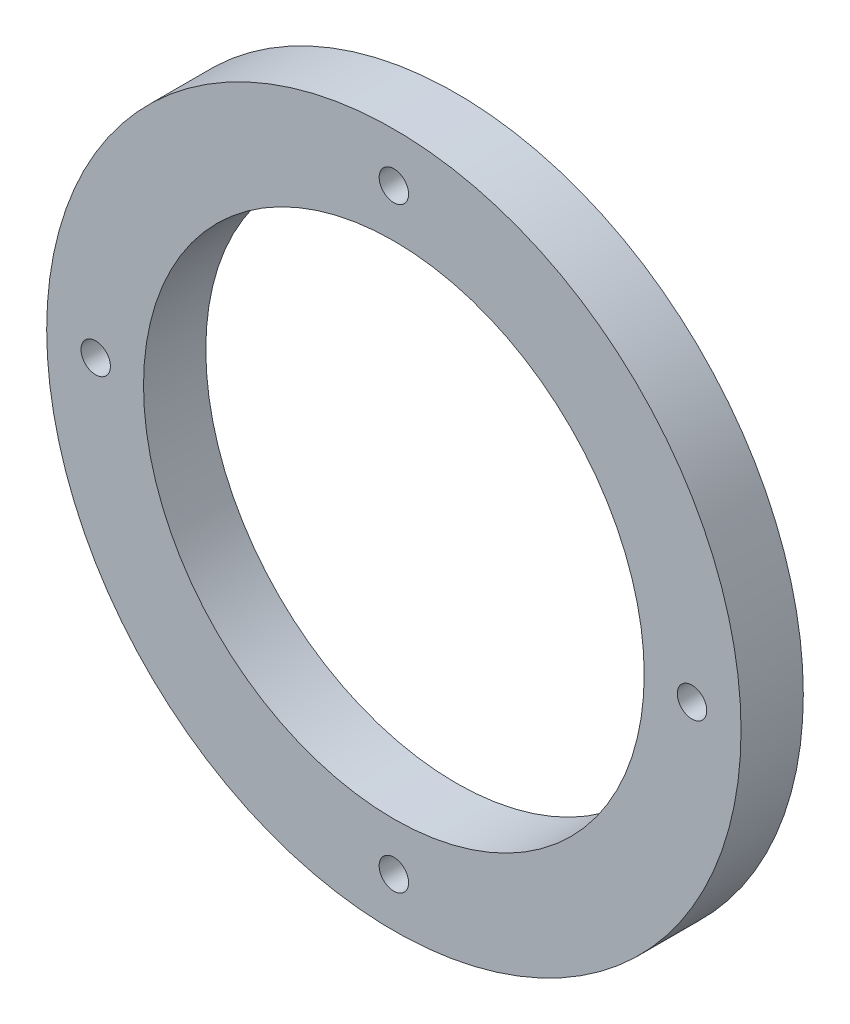
from build123d import *

# Parameters (mm, degrees)
SKETCH1_R           = 35.399999939
BOSS_EXTRUDE1_DEPTH = 6.35
SKETCH2_R           = 25.527
CUT_EXTRUDE1_DEPTH  = 6.35
SKETCH5_R           = 1.5
CUT_EXTRUDE2_DEPTH  = 6.35


with BuildPart() as part:
    # Sketch1 → Boss-Extrude1 (new body)
    with BuildSketch(Plane.XY):
        Circle(SKETCH1_R)
    extrude(amount=BOSS_EXTRUDE1_DEPTH)

    # Sketch2 → Cut-Extrude1 (cut)
    with BuildSketch(Plane.XY.offset(6.35)):
        Circle(SKETCH2_R)
    extrude(amount=-CUT_EXTRUDE1_DEPTH, mode=Mode.SUBTRACT)

    # Sketch5 → Cut-Extrude2 (cut)
    with BuildSketch(Plane.XY.offset(6.35)):
        with Locations((0, 30.400000033)):
            Circle(SKETCH5_R)
        with Locations((30.400000033, 0)):
            Circle(SKETCH5_R)
        with Locations((0, -30.400000033)):
            Circle(SKETCH5_R)
        with Locations((-30.400000033, 0)):
            Circle(SKETCH5_R)
    extrude(amount=-CUT_EXTRUDE2_DEPTH, mode=Mode.SUBTRACT)


solid = part.part
